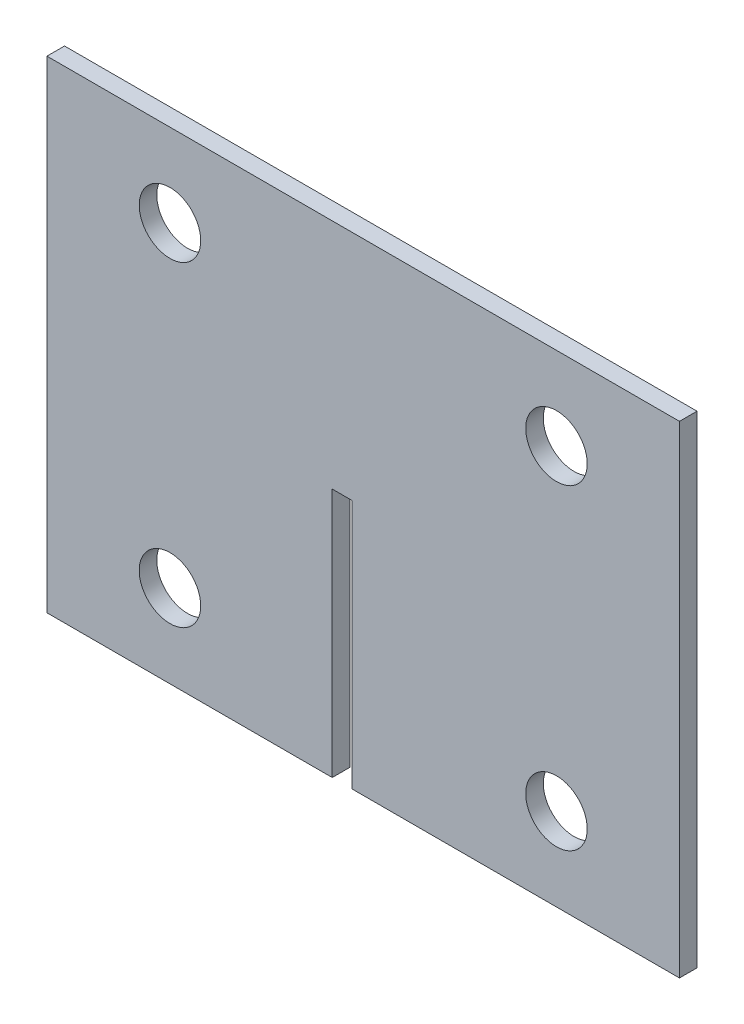
from build123d import *

# Parameters (mm, degrees)
SKETCH1_W           = 228.6
SKETCH1_H           = 174.244
BOSS_EXTRUDE1_DEPTH = 6.35
CUT_EXTRUDE1_REACH  = 1664.844
SKETCH2_R           = 11.1125
CUT_EXTRUDE2_REACH  = 1664.844
SKETCH3_W           = 7.14375
SKETCH3_H           = 90.297


with BuildPart() as part:
    # Sketch1 → Boss-Extrude1 (new body)
    with BuildSketch(Plane.XY):
        with Locations((-1533.072746981, 139.093604852)):
            Rectangle(SKETCH1_W, SKETCH1_H)
    extrude(amount=BOSS_EXTRUDE1_DEPTH)

    # Sketch2 → Cut-Extrude1 (cut, up to next)
    with BuildSketch(Plane.XY.offset(6.35), mode=Mode.PRIVATE) as cut_extrude1_sk1:
        with Locations((-1463.222746981, 196.243604852)):
            Circle(SKETCH2_R)
    cut_extrude1_tool1 = extrude(cut_extrude1_sk1.sketch, amount=-CUT_EXTRUDE1_REACH, mode=Mode.PRIVATE) & part.part
    # Sketch2 → Cut-Extrude1 (cut, up to next)
    with BuildSketch(Plane.XY.offset(6.35), mode=Mode.PRIVATE) as cut_extrude1_sk2:
        with Locations((-1463.222746981, 81.943604852)):
            Circle(SKETCH2_R)
    cut_extrude1_tool2 = extrude(cut_extrude1_sk2.sketch, amount=-CUT_EXTRUDE1_REACH, mode=Mode.PRIVATE) & part.part
    # Sketch2 → Cut-Extrude1 (cut, up to next)
    with BuildSketch(Plane.XY.offset(6.35), mode=Mode.PRIVATE) as cut_extrude1_sk3:
        with Locations((-1602.922746981, 196.243604852)):
            Circle(SKETCH2_R)
    cut_extrude1_tool3 = extrude(cut_extrude1_sk3.sketch, amount=-CUT_EXTRUDE1_REACH, mode=Mode.PRIVATE) & part.part
    # Sketch2 → Cut-Extrude1 (cut, up to next)
    with BuildSketch(Plane.XY.offset(6.35), mode=Mode.PRIVATE) as cut_extrude1_sk4:
        with Locations((-1602.922746981, 81.943604852)):
            Circle(SKETCH2_R)
    cut_extrude1_tool4 = extrude(cut_extrude1_sk4.sketch, amount=-CUT_EXTRUDE1_REACH, mode=Mode.PRIVATE) & part.part
    add(cut_extrude1_tool1.solids().sort_by_distance((-1463.222747, 196.243605, 6.35))[0], mode=Mode.SUBTRACT)
    add(cut_extrude1_tool2.solids().sort_by_distance((-1463.222747, 81.943605, 6.35))[0], mode=Mode.SUBTRACT)
    add(cut_extrude1_tool3.solids().sort_by_distance((-1602.922747, 196.243605, 6.35))[0], mode=Mode.SUBTRACT)
    add(cut_extrude1_tool4.solids().sort_by_distance((-1602.922747, 81.943605, 6.35))[0], mode=Mode.SUBTRACT)

    # Sketch3 → Cut-Extrude2 (cut, up to next)
    with BuildSketch(Plane.XY.offset(6.35), mode=Mode.PRIVATE) as cut_extrude2_sk1:
        with Locations((-1540.692746981, 97.120104852)):
            Rectangle(SKETCH3_W, SKETCH3_H)
    cut_extrude2_tool1 = extrude(cut_extrude2_sk1.sketch, amount=-CUT_EXTRUDE2_REACH, mode=Mode.PRIVATE) & part.part
    add(cut_extrude2_tool1.solids().sort_by_distance((-1540.692747, 97.120105, 6.35))[0], mode=Mode.SUBTRACT)


solid = part.part
